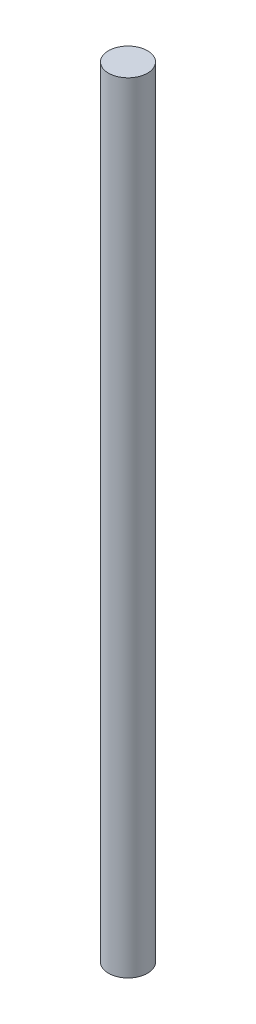
from build123d import *

# Parameters (mm, degrees)
SKETCH_1_R      = 2.5
EXTRUDE_1_DEPTH = 100


with BuildPart() as part:
    # 草图1 → 凸台-拉伸1 (new body)
    with BuildSketch(Plane(origin=(0, 0, 0), x_dir=(1, 0, 0), z_dir=(0, 1, 0))):
        with Locations(Location((0, -0.277302139, 0), (0, 0, 270))):
            Circle(SKETCH_1_R)
    extrude(amount=EXTRUDE_1_DEPTH)


solid = part.part
